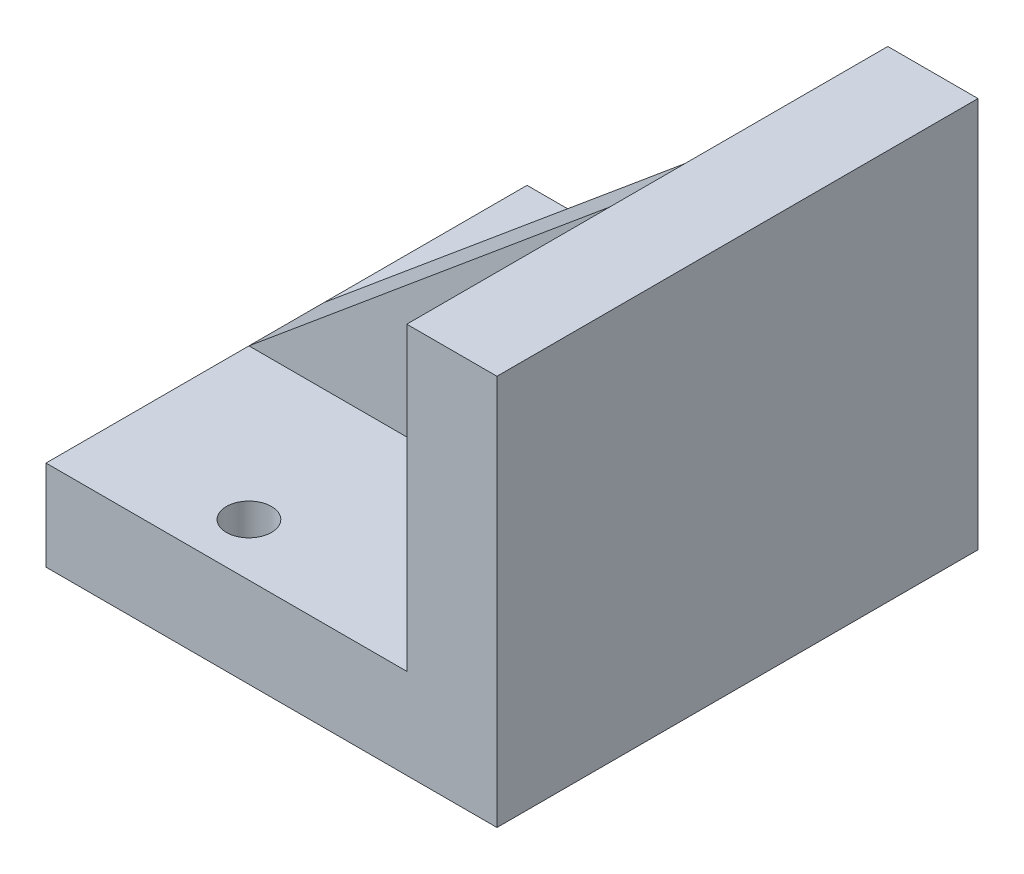
from build123d import *

# Parameters (mm, degrees)
SKETCH_1_W          = 30
SKETCH_1_H          = 32
EXTRUDE_1_DEPTH     = 6
SKETCH_2_W          = 6
SKETCH_2_H          = 32
EXTRUDE_2_DEPTH     = 20
SKETCH_4_R          = 1.5
CUT_EXTRUDE_1_DEPTH = 30.681644159
SKETCH_5_W          = 24
SKETCH_5_H          = 5
EXTRUDE_3_DEPTH     = 20
CUT_EXTRUDE_2_DEPTH = 36.259750425


with BuildPart() as part:
    # 草图1 → 凸台-拉伸1 (new body)
    with BuildSketch(Plane(origin=(0, 0, 0), x_dir=(1, 0, 0), z_dir=(0, 1, 0))):
        Rectangle(SKETCH_1_W, SKETCH_1_H)
    extrude(amount=EXTRUDE_1_DEPTH)

    # 草图2 → 凸台-拉伸2 (add)
    with BuildSketch(Plane(origin=(0, 6, 0), x_dir=(1, 0, 0), z_dir=(0, 1, 0))):
        with Locations((12, 0)):
            Rectangle(SKETCH_2_W, SKETCH_2_H)
    extrude(amount=EXTRUDE_2_DEPTH)

    # 草图4 → 切除-拉伸1 (cut, through all)
    with BuildSketch(Plane(origin=(0, 6, 0), x_dir=(1, 0, 0), z_dir=(0, 1, 0))):
        with Locations(Location((-5, 12.5, 0), (0, 0, 270))):
            Circle(SKETCH_4_R)
        with Locations(Location((-5, -12.5, 0), (0, 0, 90))):
            Circle(SKETCH_4_R)
    extrude(amount=-CUT_EXTRUDE_1_DEPTH, mode=Mode.SUBTRACT)

    # 草图5 → 凸台-拉伸3 (add, through all)
    with BuildSketch(Plane(origin=(0, 6, 0), x_dir=(1, 0, 0), z_dir=(0, 1, 0))):
        with Locations((-3, 0)):
            Rectangle(SKETCH_5_W, SKETCH_5_H)
    extrude(amount=EXTRUDE_3_DEPTH)

    # 草图6 → 切除-拉伸2 (cut, through all)
    with BuildSketch(Plane.XY.offset(2.5)):
        Polygon((-15, 6), (-15, 26), (9, 26), align=None)
    extrude(amount=-CUT_EXTRUDE_2_DEPTH, mode=Mode.SUBTRACT)


solid = part.part
